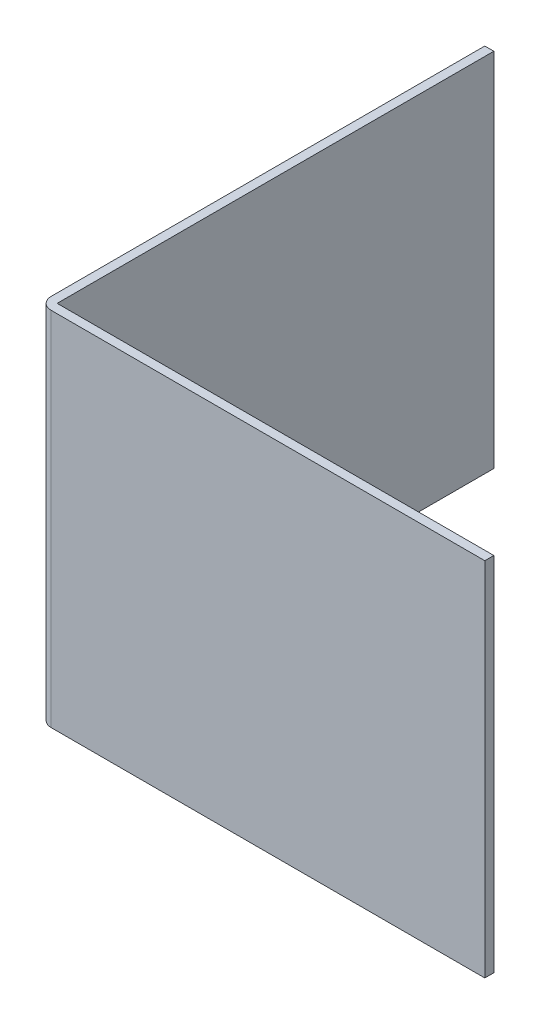
from build123d import *

# Parameters (mm, degrees)
BOSS_EXTRUDE1_DEPTH = 120
FILLET1_R           = 4


with BuildPart() as part:
    # Sketch1 → Boss-Extrude1 (new body)
    with BuildSketch(Plane(origin=(0, 0, 0), x_dir=(1, 0, 0), z_dir=(0, 1, 0))):
        Polygon((145, 0), (0, 0), (0, 145), (-3, 145), (-3, -3), (145, -3), align=None)
    extrude(amount=BOSS_EXTRUDE1_DEPTH)

    # Fillet1
    fillet1_edges = [part.edges().sort_by_distance(p)[0] for p in [
        (-3, 60, 3),
    ]]
    fillet(fillet1_edges, radius=FILLET1_R)


solid = part.part
